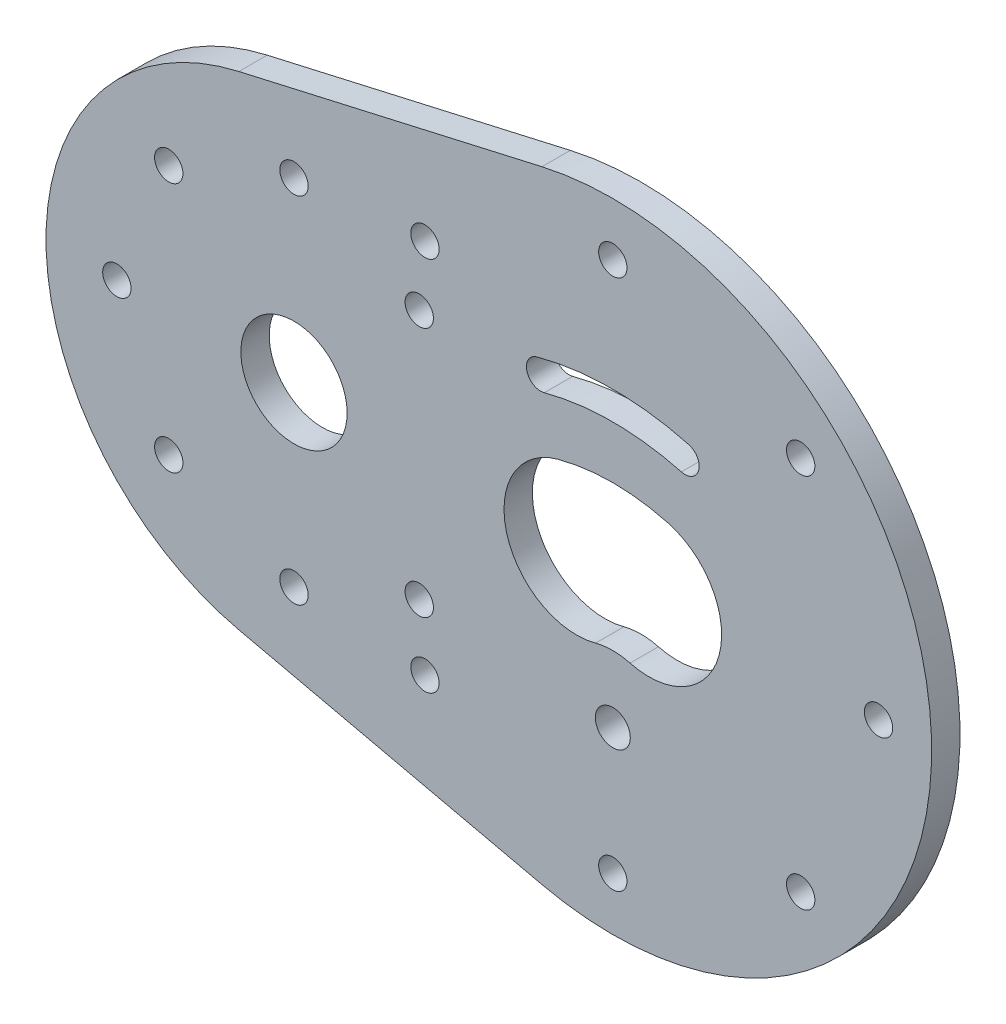
from build123d import *

# Parameters (mm, degrees)
SKETCH1_W           = 127
SKETCH1_H           = 88.9
SKETCH1_R           = 1.564880276
SKETCH1_R_2         = 4.7625
BOSS_EXTRUDE1_DEPTH = 2.54
SKETCH2_W           = 177.519600035
SKETCH2_H           = 126.718171086
CUT_EXTRUDE1_DEPTH  = 108.831991492
SKETCH4_R           = 1.27
CUT_EXTRUDE2_DEPTH  = 66.377727285


with BuildPart() as part:
    # Sketch1 → Boss-Extrude1 (new body)
    with BuildSketch(Plane.XY):
        with Locations((-28.03132955, 12.5)):
            Rectangle(SKETCH1_W, SKETCH1_H)
        Circle(SKETCH1_R, mode=Mode.SUBTRACT)
        with Locations((-28.575, 12.5)):
            Circle(SKETCH1_R_2, mode=Mode.SUBTRACT)
        with BuildLine():
            ThreePointArc((4.921470025, 18.367176179), (9.528341415, 10.387840868), (1.549006103, 5.780969478))
            ThreePointArc((1.549006103, 5.780969478), (0, 5.9849), (-1.549006103, 5.780969478))
            ThreePointArc((-1.549006103, 5.780969478), (-9.528341415, 10.387840868), (-4.921470025, 18.367176179))
            ThreePointArc((-4.921470025, 18.367176179), (0, 19.0151), (4.921470025, 18.367176179))
        make_face(mode=Mode.SUBTRACT)
        with BuildLine():
            ThreePointArc((6.799176315, 25.374871457), (0, 26.27), (-6.799176315, 25.374871457))
            ThreePointArc((-6.799176315, 25.374871457), (-7.697201927, 23.81944547), (-6.14177594, 22.921419858))
            ThreePointArc((-6.14177594, 22.921419858), (0, 23.73), (6.14177594, 22.921419858))
            ThreePointArc((6.14177594, 22.921419858), (7.697201927, 23.81944547), (6.799176315, 25.374871457))
        make_face(mode=Mode.SUBTRACT)
    extrude(amount=BOSS_EXTRUDE1_DEPTH)

    # Sketch2 → Cut-Extrude1 (cut, through all)
    with BuildSketch(Plane.XY.offset(2.54)):
        with Locations((-18.257651528, 17.008273159)):
            Rectangle(SKETCH2_W, SKETCH2_H)
        with BuildLine():
            Line((-33.513888889, 34.169287057), (-6.35, 40.36051193))
            ThreePointArc((-6.35, 40.36051193), (28.575, 12.5), (-6.35, -15.36051193))
            Line((-6.35, -15.36051193), (-33.513888889, -9.169287057))
            ThreePointArc((-33.513888889, -9.169287057), (-50.8, 12.5), (-33.513888889, 34.169287057))
        make_face(mode=Mode.SUBTRACT)
    extrude(amount=-CUT_EXTRUDE1_DEPTH, mode=Mode.SUBTRACT)

    # Sketch4 → Cut-Extrude2 (cut, through all)
    with BuildSketch(Plane.XY.offset(2.54)):
        with Locations((-28.575, 28.375)):
            Circle(SKETCH4_R)
        with Locations((0, 36.3125)):
            Circle(SKETCH4_R)
        with Locations((-17.349679849, 23.725320151)):
            Circle(SKETCH4_R)
        with Locations((-17.349679849, 1.274679849)):
            Circle(SKETCH4_R)
        with Locations((-28.575, -3.375)):
            Circle(SKETCH4_R)
        with Locations((-39.800320151, 1.274679849)):
            Circle(SKETCH4_R)
        with Locations((-44.45, 12.5)):
            Circle(SKETCH4_R)
        with Locations((-39.800320151, 23.725320151)):
            Circle(SKETCH4_R)
        with Locations((16.837980227, 29.337980227)):
            Circle(SKETCH4_R)
        with Locations((23.8125, 12.5)):
            Circle(SKETCH4_R)
        with Locations((16.837980227, -4.337980227)):
            Circle(SKETCH4_R)
        with Locations((0, -11.3125)):
            Circle(SKETCH4_R)
        with Locations((-16.837980227, -4.337980227)):
            Circle(SKETCH4_R)
        with Locations((-16.837980227, 29.337980227)):
            Circle(SKETCH4_R)
    extrude(amount=-CUT_EXTRUDE2_DEPTH, mode=Mode.SUBTRACT)


solid = part.part
